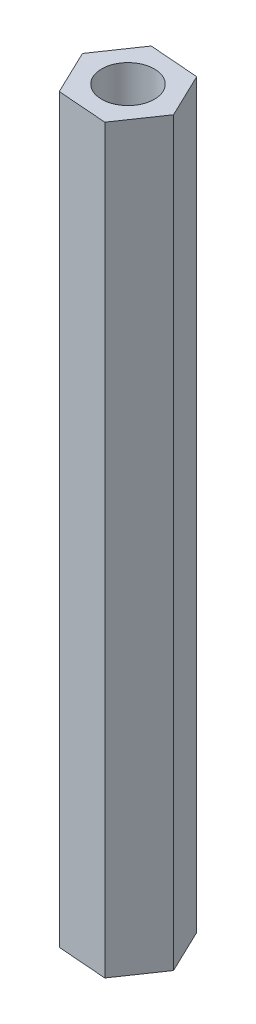
from build123d import *

# Parameters (mm, degrees)
SKETCH_1_R      = 1.6
EXTRUDE_1_DEPTH = 45


with BuildPart() as part:
    # 草图1 → 凸台-拉伸1 (new body)
    with BuildSketch(Plane(origin=(0, 0, 0), x_dir=(1, 0, 0), z_dir=(0, 1, 0))):
        Polygon((1.29843897, -2.70691514), (2.993476762, -0.228976437), (1.695037792, 2.477938703), (-1.29843897, 2.70691514), (-2.993476762, 0.228976437), (-1.695037792, -2.477938703), align=None)
        with Locations(Location((0, 0, 0), (0, 0, 90))):
            Circle(SKETCH_1_R, mode=Mode.SUBTRACT)
    extrude(amount=EXTRUDE_1_DEPTH)


solid = part.part
